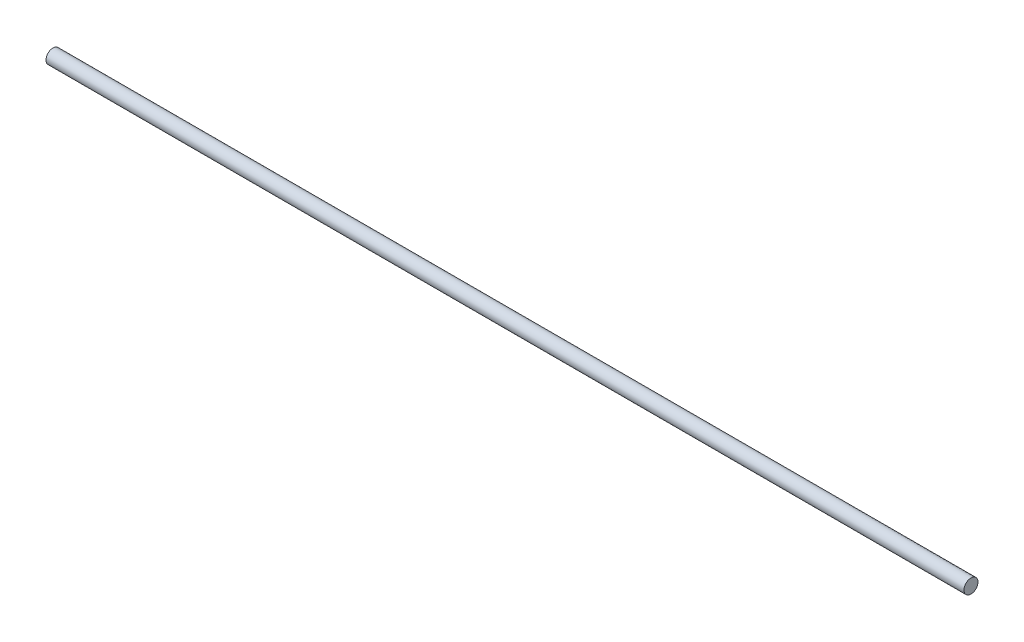
from build123d import *

# Parameters (mm, degrees)
SKETCH1_R           = 4
BOSS_EXTRUDE1_DEPTH = 261.9


with BuildPart() as part:
    # Sketch1 → Boss-Extrude1 (new, symmetric)
    with BuildSketch(Plane(origin=(0, 0, 0), x_dir=(0, 0, -1), z_dir=(1, 0, 0))):
        Circle(SKETCH1_R)
    extrude(amount=BOSS_EXTRUDE1_DEPTH, both=True)


solid = part.part
